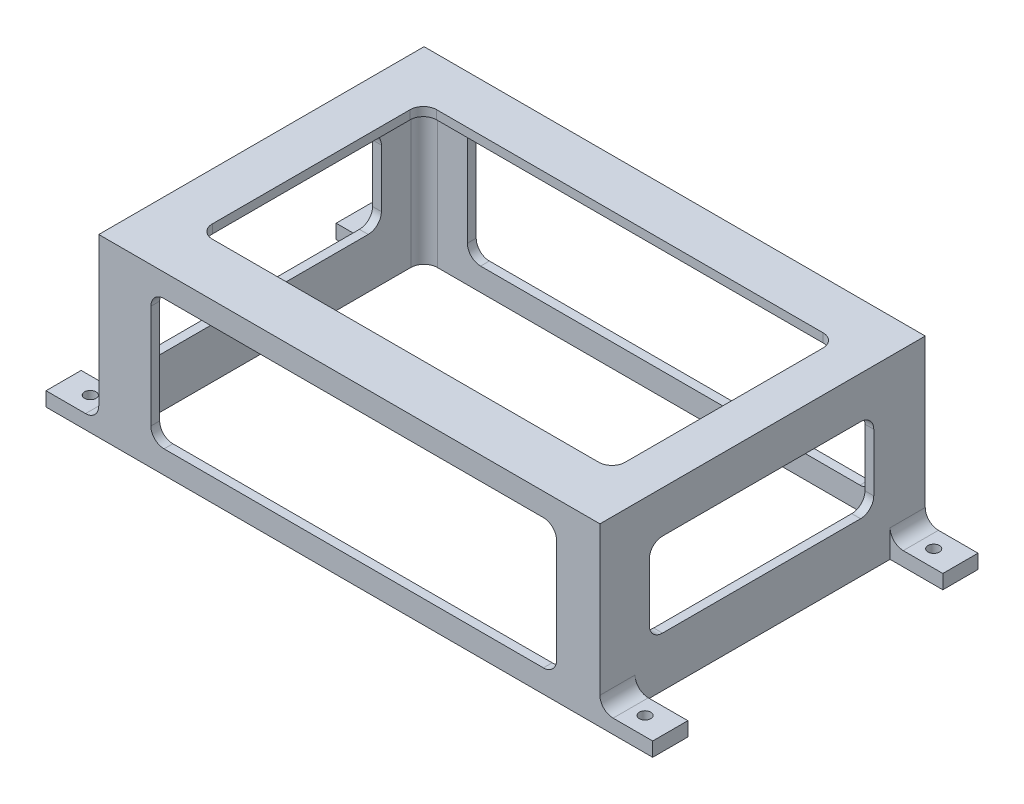
from build123d import *

# Parameters (mm, degrees)
SKETCH1_W           = 114
SKETCH1_H           = 74
BOSS_EXTRUDE1_DEPTH = 40
SHELL1_T            = -2
SKETCH2_W           = 8
SKETCH2_H           = 3.224245312
BOSS_EXTRUDE2_DEPTH = 12
CUT_EXTRUDE1_REACH  = 89.92
SKETCH3_W           = 93.912635184
SKETCH3_H           = 51.017060478
SKETCH4_W           = 51.053224202
SKETCH4_H           = 19.102136622
CUT_EXTRUDE2_DEPTH  = 138.277092044
SKETCH5_W           = 92.288442818
SKETCH5_H           = 29.598231076
CUT_EXTRUDE3_DEPTH  = 109.797977922
SKETCH6_W           = 4.328253691
SKETCH6_H           = 19.102136622
CUT_EXTRUDE4_DEPTH  = 12
FILLET1_R           = 3
SKETCH7_R           = 1.3
CUT_EXTRUDE5_DEPTH  = 12


with BuildPart() as part:
    # Sketch1 → Boss-Extrude1 (new body)
    with BuildSketch(Plane(origin=(0, 0, 0), x_dir=(1, 0, 0), z_dir=(0, 1, 0))):
        Rectangle(SKETCH1_W, SKETCH1_H)
    extrude(amount=BOSS_EXTRUDE1_DEPTH)

    # Shell1
    shell1_openings = [part.faces().sort_by_distance(p)[0] for p in [
        (0, 0, 0),
    ]]
    offset(amount=SHELL1_T, openings=shell1_openings, kind=Kind.INTERSECTION)

    # Sketch2 → Boss-Extrude2 (add)
    with BuildSketch(Plane.ZY.offset(57)):
        with Locations((-33, 1.612122656)):
            Rectangle(SKETCH2_W, SKETCH2_H)
        with Locations((33, 1.612122656)):
            Rectangle(SKETCH2_W, SKETCH2_H)
    boss_extrude2 = extrude(amount=BOSS_EXTRUDE2_DEPTH)

    # Mirror1: Boss-Extrude2 across plane
    add(boss_extrude2.mirror(Plane.ZY))

    # Sketch3 → Cut-Extrude1 (cut, up to next)
    with BuildSketch(Plane(origin=(0, 40, 0), x_dir=(1, 0, 0), z_dir=(0, 1, 0)), mode=Mode.PRIVATE) as cut_extrude1_sk1:
        with Locations((0.781529231, 0.507308448)):
            Rectangle(SKETCH3_W, SKETCH3_H)
    cut_extrude1_tool1 = extrude(cut_extrude1_sk1.sketch, amount=-CUT_EXTRUDE1_REACH, mode=Mode.PRIVATE) & part.part
    add(cut_extrude1_tool1.solids().sort_by_distance((0.781529, 40, -0.507308))[0], mode=Mode.SUBTRACT)

    # Sketch4 → Cut-Extrude2 (cut, through all)
    with BuildSketch(Plane.ZY.offset(57)):
        with Locations((0.2378186, 20.916211941)):
            Rectangle(SKETCH4_W, SKETCH4_H)
    extrude(amount=-CUT_EXTRUDE2_DEPTH, mode=Mode.SUBTRACT)

    # Sketch5 → Cut-Extrude3 (cut, through all)
    with BuildSketch(Plane.XY.offset(37)):
        with Locations((1, 20)):
            Rectangle(SKETCH5_W, SKETCH5_H)
    extrude(amount=-CUT_EXTRUDE3_DEPTH, mode=Mode.SUBTRACT)

    # Sketch6 → Cut-Extrude4 (cut)
    with BuildSketch(Plane.ZY.offset(57)):
        with Locations((27.928557547, 20.916211941)):
            Rectangle(SKETCH6_W, SKETCH6_H)
    extrude(amount=-CUT_EXTRUDE4_DEPTH, mode=Mode.SUBTRACT)

    # Fillet1
    fillet1_edges = [part.edges().sort_by_distance(p)[0] for p in [
        (47.144221409, 34.799115538, -36),
        (47.144221409, 5.200884462, -36),
        (-45.144221409, 5.200884462, -36),
        (-45.144221409, 34.799115538, -36),
        (47.144221409, 34.799115538, 36),
        (47.144221409, 5.200884462, 36),
        (-45.144221409, 5.200884462, 36),
        (-45.144221409, 34.799115538, 36),
        (-56, 30.467280252, 30.092684392),
        (-56, 11.36514363, 30.092684392),
        (55, 19, 35),
        (55, 19, -35),
        (-55, 19, -35),
        (-55, 19, 35),
        (55, 38, 0),
        (0, 38, -35),
        (-55, 38, 0),
        (0, 38, 35),
        (-57, 3.224245312, -33),
        (-57, 3.224245312, 33),
        (57, 3.224245312, -33),
        (57, 3.224245312, 33),
        (-46.174788361, 39, 25.001221791),
        (-46.174788361, 39, -26.015838687),
        (47.737846823, 39, -26.015838687),
        (47.737846823, 39, 25.001221791),
        (56, 30.467280252, 25.764430701),
        (56, 11.36514363, 25.764430701),
        (56, 11.36514363, -25.288793501),
        (56, 30.467280252, -25.288793501),
        (-56, 11.36514363, -25.288793501),
        (-56, 30.467280252, -25.288793501),
    ]]
    fillet(fillet1_edges, radius=FILLET1_R)

    # Sketch7 → Cut-Extrude5 (cut)
    with BuildSketch(Plane.XZ):
        with Locations(Location((-63.1, -32.825, 0), (0, 0, 270))):
            Circle(SKETCH7_R)
        with Locations(Location((-63.1, 32.825, 0), (0, 0, 270))):
            Circle(SKETCH7_R)
        with Locations(Location((63.1, 32.825, 0), (0, 0, 270))):
            Circle(SKETCH7_R)
        with Locations(Location((63.1, -32.825, 0), (0, 0, 270))):
            Circle(SKETCH7_R)
    extrude(amount=-CUT_EXTRUDE5_DEPTH, mode=Mode.SUBTRACT)


solid = part.part
